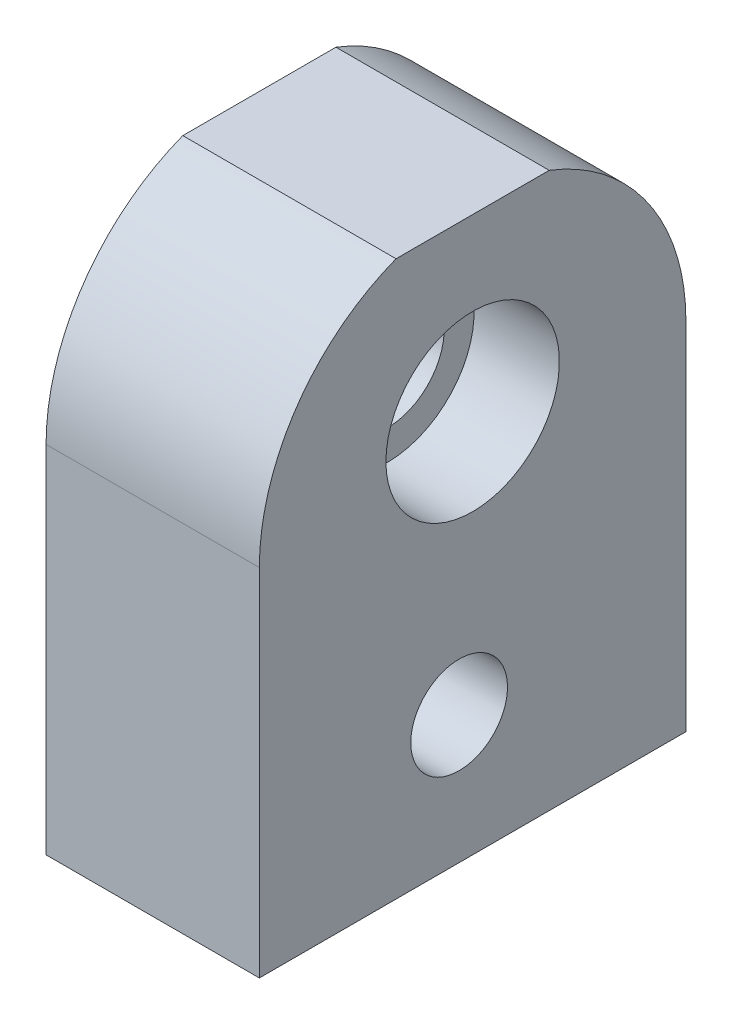
from build123d import *

# Parameters (mm, degrees)
SKETCH_1_W               = 15
SKETCH_1_H               = 30
EXTRUDE_1_DEPTH          = 25
SKETCH_3_R               = 15
EXTRUDE_3_DEPTH          = 15
CUT_EXTRUDE_2_DEPTH      = 10
SKETCH_9_R               = 6.1
CUT_EXTRUDE_3_DEPTH      = 6
SKETCH_10_R              = 4
CUT_EXTRUDE_4_DEPTH      = 51.803543184
CUT_EXTRUDE_6_DEPTH      = 53.201532545
CUT_EXTRUDE_6_DEPTH_BACK = 53.201532545
SKETCH_5_R               = 3.4
CUT_EXTRUDE_8_DEPTH      = 52.439284598


with BuildPart() as part:
    # 草图1 → 凸台-拉伸1 (new body)
    with BuildSketch(Plane(origin=(0, 0, 0), x_dir=(1, 0, 0), z_dir=(0, 1, 0))):
        with Locations((7.5, -15)):
            Rectangle(SKETCH_1_W, SKETCH_1_H)
    extrude(amount=EXTRUDE_1_DEPTH)

    # 草图3 → 凸台-拉伸3 (add)
    with BuildSketch(Plane.ZY):
        with Locations((15, 25)):
            Circle(SKETCH_3_R)
    extrude(amount=-EXTRUDE_3_DEPTH)

    # 草图4 → 切除-拉伸2 (cut)
    with BuildSketch(Plane.XZ):
        with BuildLine():
            ThreePointArc((9.15, 24), (8.666726189, 25.166726189), (7.5, 25.65))
            Line((7.5, 25.65), (7.5, 22.35))
            ThreePointArc((7.5, 22.35), (8.666726189, 22.833273811), (9.15, 24))
        make_face()
        with BuildLine():
            Line((7.5, 22.35), (7.5, 25.65))
            ThreePointArc((7.5, 25.65), (5.85, 24), (7.5, 22.35))
        make_face()
        with BuildLine():
            ThreePointArc((9.15, 6), (8.666726189, 7.166726189), (7.5, 7.65))
            Line((7.5, 7.65), (7.5, 4.35))
            ThreePointArc((7.5, 4.35), (8.666726189, 4.833273811), (9.15, 6))
        make_face()
        with BuildLine():
            Line((7.5, 4.35), (7.5, 7.65))
            ThreePointArc((7.5, 7.65), (5.85, 6), (7.5, 4.35))
        make_face()
    extrude(amount=-CUT_EXTRUDE_2_DEPTH, mode=Mode.SUBTRACT)

    # 草图9 → 切除-拉伸3 (cut)
    with BuildSketch(Plane.ZY):
        with Locations((15, 27)):
            Circle(SKETCH_9_R)
    extrude(amount=-CUT_EXTRUDE_3_DEPTH, mode=Mode.SUBTRACT)

    # 草图10 → 切除-拉伸4 (cut, through all)
    with BuildSketch(Plane.ZY.offset(-6)):
        with Locations((15, 27)):
            Circle(SKETCH_10_R)
    extrude(amount=-CUT_EXTRUDE_4_DEPTH, mode=Mode.SUBTRACT)


with BuildPart() as body_2:
    # 镜向1: mirrored copy
    add(part.part.mirror(Plane(origin=(0, 0, 0), x_dir=(0, 0, 1), z_dir=(1, 0, 0))))

    # 草图12 → 切除-拉伸6 (cut, two sides: drawn at the far end of the back side and taken through both)
    with BuildSketch(Plane(origin=(0, 0, 0), x_dir=(0, 0, -1), z_dir=(1, 0, 0)).offset(-CUT_EXTRUDE_6_DEPTH_BACK)):
        with BuildLine():
            ThreePointArc((-9.614835193, 39), (-15, 40), (-20.385164807, 39))
            Line((-20.385164807, 39), (-9.614835193, 39))
        make_face()
    extrude(amount=CUT_EXTRUDE_6_DEPTH + CUT_EXTRUDE_6_DEPTH_BACK, mode=Mode.SUBTRACT)

    # 草图5 → 切除-拉伸8 (cut, through all)
    with BuildSketch(Plane.ZY):
        with Locations((15.95, 9)):
            Circle(SKETCH_5_R)
    extrude(amount=CUT_EXTRUDE_8_DEPTH, mode=Mode.SUBTRACT)


solid = body_2.part
